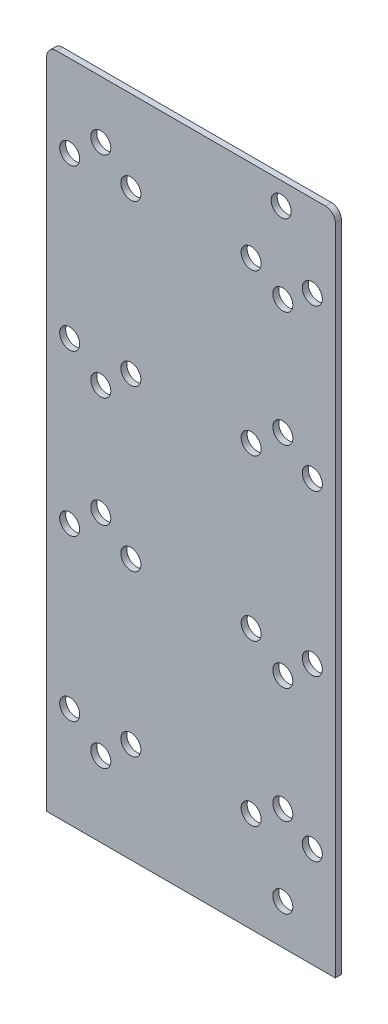
from build123d import *

# Parameters (mm, degrees)
SKETCH1_W           = 144
SKETCH1_H           = 331
BOSS_EXTRUDE1_DEPTH = 3
SKETCH2_R           = 5
CUT_EXTRUDE1_DEPTH  = 543.073379748
SKETCH3_R           = 5
CUT_EXTRUDE2_DEPTH  = 10
SKETCH4_R           = 5
CUT_EXTRUDE3_DEPTH  = 10
LPATTERN1_COUNT     = 4
LPATTERN1_PITCH     = 80
FILLET1_R           = 5


with BuildPart() as part:
    # Sketch1 → Boss-Extrude1 (new body)
    with BuildSketch(Plane.XY.offset(3)):
        with Locations((18.851179955, 368.89742901)):
            Rectangle(SKETCH1_W, SKETCH1_H)
    extrude(amount=-BOSS_EXTRUDE1_DEPTH)

    # Sketch2 → Cut-Extrude1 (cut, through all)
    with BuildSketch(Plane.XY.offset(3)):
        with Locations((63.851179955, 523.39742901)):
            Circle(SKETCH2_R)
        with Locations((64.635907686, 483.39742901)):
            Circle(SKETCH2_R)
        with Locations((64.635907686, 425.89742901)):
            Circle(SKETCH2_R)
        with Locations((64.635907686, 320.89742901)):
            Circle(SKETCH2_R)
        with Locations((64.635907686, 263.39742901)):
            Circle(SKETCH2_R)
        with Locations((64.635907686, 223.39742901)):
            Circle(SKETCH2_R)
    extrude(amount=-CUT_EXTRUDE1_DEPTH, mode=Mode.SUBTRACT)

    # Sketch3 → Cut-Extrude2 (cut)
    with BuildSketch(Plane.XY.offset(3)):
        with Locations((-26.148820045, 505.89742901)):
            Circle(SKETCH3_R)
        with Locations((-26.148820045, 400.89742901)):
            Circle(SKETCH3_R)
        with Locations((-26.148820045, 345.89742901)):
            Circle(SKETCH3_R)
        with Locations((-26.148820045, 240.89742901)):
            Circle(SKETCH3_R)
    extrude(amount=-CUT_EXTRUDE2_DEPTH, mode=Mode.SUBTRACT)

    # Sketch4 → Cut-Extrude3 (cut)
    with BuildSketch(Plane.XY.offset(3)):
        with Locations((-41.648820045, 253.39742901)):
            Circle(SKETCH4_R)
        with Locations((-11.148820045, 253.39742901)):
            Circle(SKETCH4_R)
        with Locations((48.851179955, 253.39742901)):
            Circle(SKETCH4_R)
        with Locations((79.351179955, 253.39742901)):
            Circle(SKETCH4_R)
    cut_extrude3 = extrude(amount=-CUT_EXTRUDE3_DEPTH, mode=Mode.SUBTRACT)

    # LPattern1: Cut-Extrude3 ×4
    with Locations(*[(0, i * LPATTERN1_PITCH, 0) for i in range(1, LPATTERN1_COUNT)]):
        add(cut_extrude3, mode=Mode.SUBTRACT)

    # Fillet1
    fillet1_edges = [part.edges().sort_by_distance(p)[0] for p in [
        (-53.148820045, 534.39742901, 1.5),
        (90.851179955, 534.39742901, 1.5),
    ]]
    fillet(fillet1_edges, radius=FILLET1_R)


solid = part.part
